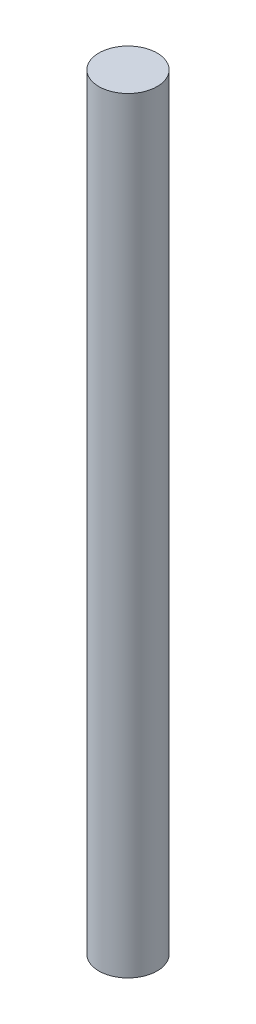
from build123d import *

# Parameters (mm, degrees)
SKETCH1_R           = 0.95
BOSS_EXTRUDE1_DEPTH = 25


with BuildPart() as part:
    # Sketch1 → Boss-Extrude1 (new body)
    with BuildSketch(Plane(origin=(0, 0, 0), x_dir=(1, 0, 0), z_dir=(0, 1, 0))):
        with Locations(Location((0, 0, 0), (0, 0, 270))):
            Circle(SKETCH1_R)
    extrude(amount=BOSS_EXTRUDE1_DEPTH)


solid = part.part
